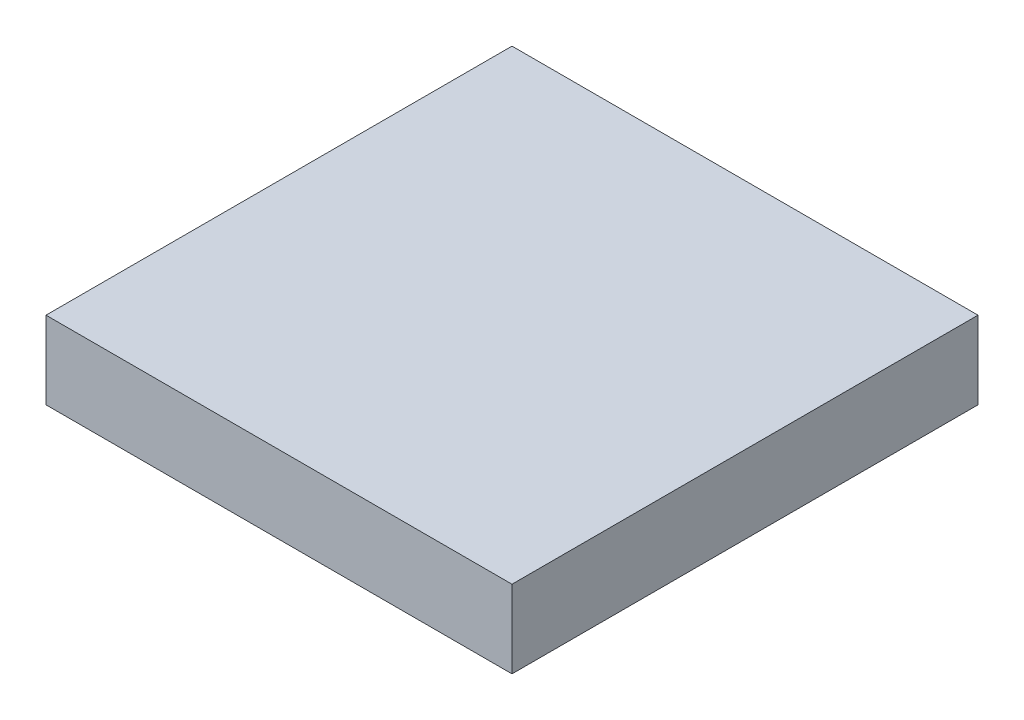
from build123d import *

# Parameters (mm, degrees)
SKETCH1_W           = 3000
SKETCH1_H           = 3000
BOSS_EXTRUDE1_DEPTH = 500


with BuildPart() as part:
    # Sketch1 → Boss-Extrude1 (new body)
    with BuildSketch(Plane(origin=(0, 0, 0), x_dir=(1, 0, 0), z_dir=(0, 1, 0))):
        with Locations((1500, 1500)):
            Rectangle(SKETCH1_W, SKETCH1_H)
    extrude(amount=BOSS_EXTRUDE1_DEPTH)


solid = part.part
